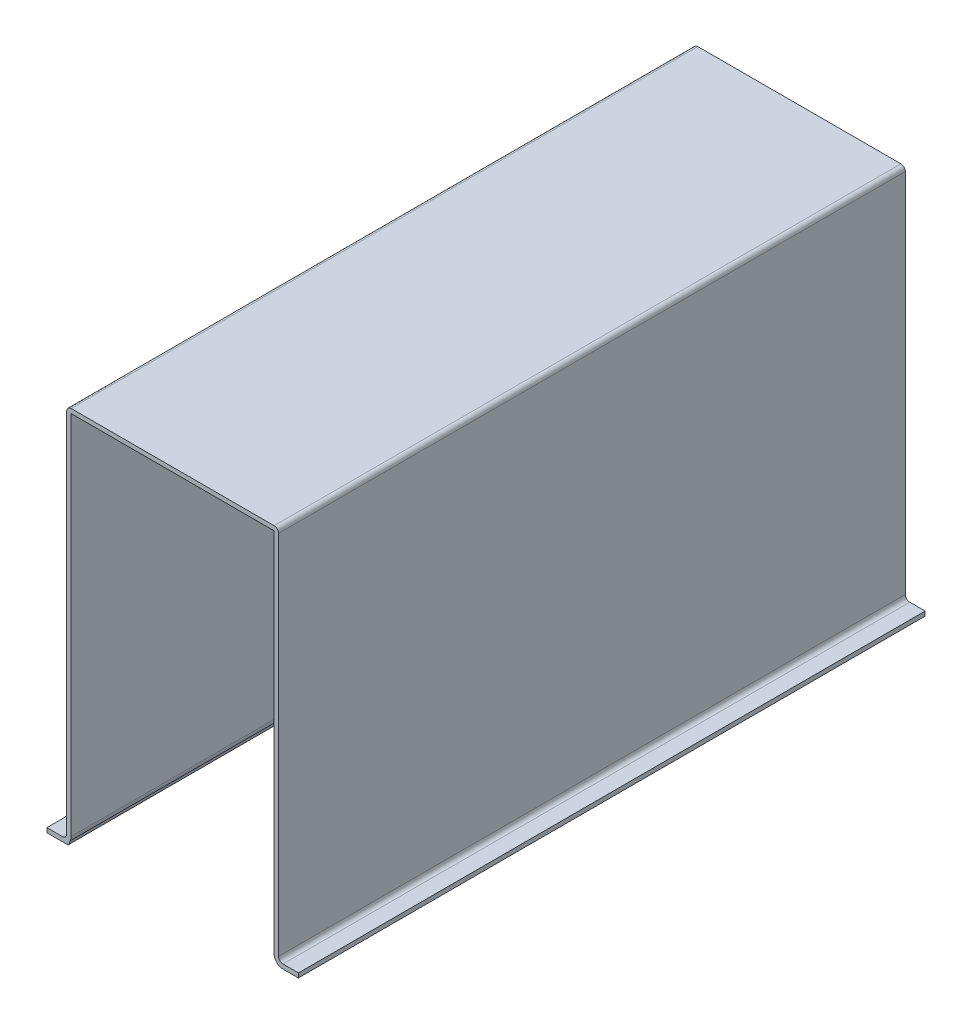
from build123d import *

# Parameters (mm, degrees)
BOSS_EXTRUDE1_DEPTH = 284
CUT_EXTRUDE1_DEPTH  = 336.560724758
CUT_EXTRUDE3_DEPTH  = 284
SKETCH5_W           = 284
SKETCH5_H           = 2
BOSS_EXTRUDE2_DEPTH = 5
SKETCH6_W           = 284
SKETCH6_H           = 2
BOSS_EXTRUDE3_DEPTH = 5


with BuildPart() as part:
    # Sketch1 → Boss-Extrude1 (new body)
    with BuildSketch(Plane.XY):
        with BuildLine():
            Line((50, 1), (52, 1))
            Line((52, 1), (52, -1))
            Line((52, -1), (-52, -1))
            Line((-52, -1), (-52, 1))
            Line((-52, 1), (-50, 1))
            ThreePointArc((-50, 1), (-48.585786438, 1.585786438), (-48, 3))
            Line((-48, 3), (-48, 169))
            ThreePointArc((-48, 169), (-47.414213562, 170.414213562), (-46, 171))
            Line((-46, 171), (46, 171))
            ThreePointArc((46, 171), (47.414213562, 170.414213562), (48, 169))
            Line((48, 169), (48, 3))
            ThreePointArc((48, 3), (48.585786438, 1.585786438), (50, 1))
        make_face()
    extrude(amount=BOSS_EXTRUDE1_DEPTH)

    # Sketch2 → Cut-Extrude1 (cut, through all)
    with BuildSketch(Plane(origin=(0, 0, 0), x_dir=(-1, 0, 0), z_dir=(0, 0, -1))):
        with BuildLine():
            Line((-46.535898385, 1), (46.535898385, 1))
            ThreePointArc((46.535898385, 1), (46.136296695, 1.96472382), (46, 3))
            Line((46, 3), (46, 169))
            Line((46, 169), (-46, 169))
            Line((-46, 169), (-46, 3))
            ThreePointArc((-46, 3), (-46.136296695, 1.96472382), (-46.535898385, 1))
        make_face()
    extrude(amount=-CUT_EXTRUDE1_DEPTH, mode=Mode.SUBTRACT)

    # Sketch3 → Cut-Extrude3 (cut)
    with BuildSketch(Plane(origin=(0, 0, 0), x_dir=(-1, 0, 0), z_dir=(0, 0, -1))):
        with BuildLine():
            Line((-50.018137883, -1.031749995), (49.461412471, -2.32808526))
            ThreePointArc((49.461412471, -2.32808526), (47.495708501, -1.106152193), (46.535898385, 1))
            Line((46.535898385, 1), (-46.535898385, 1))
            ThreePointArc((-46.535898385, 1), (-48.002325394, -0.486674019), (-50.018137883, -1.031749995))
        make_face()
    extrude(amount=-CUT_EXTRUDE3_DEPTH, mode=Mode.SUBTRACT)

    # Sketch5 → Boss-Extrude2 (add)
    with BuildSketch(Plane.ZY.offset(52)):
        with Locations((142, 0)):
            Rectangle(SKETCH5_W, SKETCH5_H)
    extrude(amount=BOSS_EXTRUDE2_DEPTH)

    # Sketch6 → Boss-Extrude3 (add)
    with BuildSketch(Plane(origin=(52, 0, 0), x_dir=(0, 0, -1), z_dir=(1, 0, 0))):
        with Locations((-142, 0)):
            Rectangle(SKETCH6_W, SKETCH6_H)
    extrude(amount=BOSS_EXTRUDE3_DEPTH)


solid = part.part
